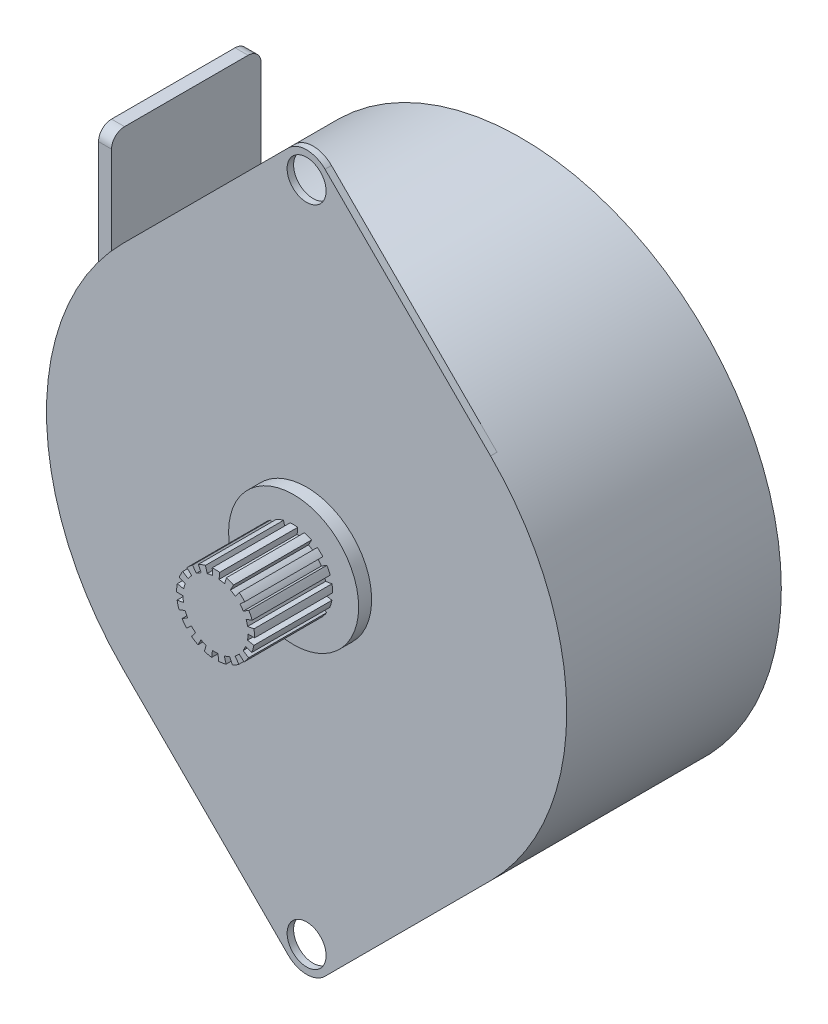
from build123d import *
from build123d.topology import SkipClean

# Parameters (mm, degrees)
SKETCH1_R           = 20
BOSS_EXTRUDE1_DEPTH = 16
BOSS_EXTRUDE3_START = 0.5
SKETCH3_R           = 1.5
BOSS_EXTRUDE3_DEPTH = 0.5
SKETCH4_R           = 5
BOSS_EXTRUDE4_DEPTH = 1
SKETCH5_R           = 3
BOSS_EXTRUDE5_DEPTH = 6
CUT_EXTRUDE1_START  = -6
CUT_EXTRUDE1_DEPTH  = 6
SKETCH8_W           = 11.5
SKETCH8_H           = 23
BOSS_EXTRUDE6_DEPTH = 1
FILLET1_R           = 1


with BuildPart() as part:
    # Sketch1 → Boss-Extrude1 (new body)
    with BuildSketch(Plane.XY):
        Circle(SKETCH1_R)
    extrude(amount=-BOSS_EXTRUDE1_DEPTH)

    # Sketch3 → Boss-Extrude3 (add)
    with SkipClean():  # the faces are left unmerged after this step: merging them gives an invalid solid
        with BuildSketch(Plane.XY.offset(BOSS_EXTRUDE3_START)):
            with BuildLine():
                Line((-14.142135624, 14.142135624), (-1.414213562, 26.870057685))
                ThreePointArc((-1.414213562, 26.870057685), (0, 27.455844123), (1.414213562, 26.870057685))
                Line((1.414213562, 26.870057685), (14.142135624, 14.142135624))
                ThreePointArc((14.142135624, 14.142135624), (20, 0), (14.142135624, -14.142135624))
                Line((14.142135624, -14.142135624), (1.414213562, -26.870057685))
                ThreePointArc((1.414213562, -26.870057685), (0, -27.455844123), (-1.414213562, -26.870057685))
                Line((-1.414213562, -26.870057685), (-14.142135624, -14.142135624))
                ThreePointArc((-14.142135624, -14.142135624), (-20, 0), (-14.142135624, 14.142135624))
            make_face()
            with Locations((0, -25.455844123)):
                Circle(SKETCH3_R, mode=Mode.SUBTRACT)
            with Locations((0, 25.455844123)):
                Circle(SKETCH3_R, mode=Mode.SUBTRACT)
        extrude(amount=-BOSS_EXTRUDE3_DEPTH)

    # Sketch4 → Boss-Extrude4 (add)
    with SkipClean():  # the faces are left unmerged after this step: merging them gives an invalid solid
        with BuildSketch(Plane.XY.offset(0.5)):
            with Locations(Location((0, 0, 0), (0, 0, 180))):
                Circle(SKETCH4_R)
        extrude(amount=BOSS_EXTRUDE4_DEPTH)

    # Sketch5 → Boss-Extrude5 (add)
    with SkipClean():  # the faces are left unmerged after this step: merging them gives an invalid solid
        with BuildSketch(Plane.XY.offset(1.5)):
            Circle(SKETCH5_R)
        extrude(amount=BOSS_EXTRUDE5_DEPTH)

    # Sketch6 → Cut-Extrude1 (cut)
    with SkipClean():  # the faces are left unmerged after this step: merging them gives an invalid solid
        with BuildSketch(Plane.XY.offset(7.5).offset(CUT_EXTRUDE1_START)):
            with BuildLine():
                Line((-2.464171335, -0.421734077), (-2.957005602, -0.506080893))
                ThreePointArc((-2.957005602, -0.506080893), (-2.989861159, -0.246435082), (-2.999962067, 0.015086247))
                Line((-2.999962067, 0.015086247), (-2.499968389, 0.012571873))
                ThreePointArc((-2.499968389, 0.012571873), (-2.491550966, -0.205362569), (-2.464171335, -0.421734077))
            make_face()
            with BuildLine():
                Line((-2.450119259, 0.496906044), (-2.940143111, 0.596287252))
                ThreePointArc((-2.940143111, 0.596287252), (-2.87698512, 0.850268556), (-2.791931536, 1.097778802))
                Line((-2.791931536, 1.097778802), (-2.326609613, 0.914815669))
                ThreePointArc((-2.326609613, 0.914815669), (-2.3974876, 0.70855713), (-2.450119259, 0.496906044))
            make_face()
            with BuildLine():
                Line((-2.145423418, -1.283416674), (-2.574508101, -1.540100009))
                ThreePointArc((-2.574508101, -1.540100009), (-2.698939881, -1.309856297), (-2.802831098, -1.069643789))
                Line((-2.802831098, -1.069643789), (-2.335692582, -0.891369824))
                ThreePointArc((-2.335692582, -0.891369824), (-2.249116567, -1.091546915), (-2.145423418, -1.283416674))
            make_face()
            with BuildLine():
                Line((-2.105165001, 1.34843625), (-2.526198001, 1.6181235))
                ThreePointArc((-2.526198001, 1.6181235), (-2.375556299, 1.832138714), (-2.20683518, 2.032210247))
                Line((-2.20683518, 2.032210247), (-1.839029317, 1.693508539))
                ThreePointArc((-1.839029317, 1.693508539), (-1.979630249, 1.526782262), (-2.105165001, 1.34843625))
            make_face()
            with BuildLine():
                Line((-1.475896544, 2.017852669), (-1.771075853, 2.421423202))
                ThreePointArc((-1.771075853, 2.421423202), (-1.553295437, 2.566568387), (-1.323693504, 2.692180437))
                Line((-1.323693504, 2.692180437), (-1.10307792, 2.243483698))
                ThreePointArc((-1.10307792, 2.243483698), (-1.294412864, 2.138806989), (-1.475896544, 2.017852669))
            make_face()
            with BuildLine():
                Line((-0.64730008, 2.414746903), (-0.776760097, 2.897696284))
                ThreePointArc((-0.776760097, 2.897696284), (-0.521253418, 2.954368778), (-0.261779686, 2.988556741))
                Line((-0.261779686, 2.988556741), (-0.218149739, 2.490463951))
                ThreePointArc((-0.218149739, 2.490463951), (-0.434377848, 2.461973981), (-0.64730008, 2.414746903))
            make_face()
            with BuildLine():
                Line((0.268717846, 2.485516188), (0.322461415, 2.982619425))
                ThreePointArc((0.322461415, 2.982619425), (0.581186763, 2.943165294), (0.835488929, 2.881311897))
                Line((0.835488929, 2.881311897), (0.696240774, 2.401093248))
                ThreePointArc((0.696240774, 2.401093248), (0.484322303, 2.452637745), (0.268717846, 2.485516188))
            make_face()
            with BuildLine():
                Line((1.148443938, 2.220602739), (1.378132725, 2.664723286))
                ThreePointArc((1.378132725, 2.664723286), (1.605134451, 2.534471028), (1.819920135, 2.384929916))
                Line((1.819920135, 2.384929916), (1.516600112, 1.987441596))
                ThreePointArc((1.516600112, 1.987441596), (1.337612043, 2.11205919), (1.148443938, 2.220602739))
            make_face()
            with BuildLine():
                Line((1.873066312, 1.655784585), (2.247679574, 1.986941502))
                ThreePointArc((2.247679574, 1.986941502), (2.412299837, 1.783482407), (2.558561042, 1.566449934))
                Line((2.558561042, 1.566449934), (2.132134202, 1.305374945))
                ThreePointArc((2.132134202, 1.305374945), (2.010249864, 1.486235339), (1.873066312, 1.655784585))
            make_face()
            with BuildLine():
                Line((2.344720702, 0.867343548), (2.813664842, 1.040812257))
                ThreePointArc((2.813664842, 1.040812257), (2.893670764, 0.791624603), (2.951654103, 0.536412208))
                Line((2.951654103, 0.536412208), (2.459711752, 0.447010173))
                ThreePointArc((2.459711752, 0.447010173), (2.411392303, 0.659687169), (2.344720702, 0.867343548))
            make_face()
            with BuildLine():
                Line((2.499707569, -0.038237042), (2.999649082, -0.04588445))
                ThreePointArc((2.999649082, -0.04588445), (2.984235419, -0.307146489), (2.946109922, -0.566070959))
                Line((2.946109922, -0.566070959), (2.455091601, -0.471725799))
                ThreePointArc((2.455091601, -0.471725799), (2.486862849, -0.255955408), (2.499707569, -0.038237042))
            make_face()
            with BuildLine():
                Line((2.317095077, -0.938653506), (2.780514092, -1.126384208))
                ThreePointArc((2.780514092, -1.126384208), (2.671762544, -1.364435747), (2.54267727, -1.592103106))
                Line((2.54267727, -1.592103106), (2.118897725, -1.326752588))
                ThreePointArc((2.118897725, -1.326752588), (2.226468787, -1.137029789), (2.317095077, -0.938653506))
            make_face()
            with BuildLine():
                Line((1.821546055, -1.712299614), (2.185855266, -2.054759537))
                ThreePointArc((2.185855266, -2.054759537), (1.998453334, -2.237450396), (1.795841964, -2.403112906))
                Line((1.795841964, -2.403112906), (1.49653497, -2.002594088))
                ThreePointArc((1.49653497, -2.002594088), (1.665377778, -1.864541996), (1.821546055, -1.712299614))
            make_face()
            with BuildLine():
                Line((1.079987146, -2.254690171), (1.295984575, -2.705628205))
                ThreePointArc((1.295984575, -2.705628205), (1.055241926, -2.808284971), (0.80646825, -2.889568992))
                Line((0.80646825, -2.889568992), (0.672056875, -2.40797416))
                ThreePointArc((0.672056875, -2.40797416), (0.879368272, -2.340237476), (1.079987146, -2.254690171))
            make_face()
            with BuildLine():
                Line((0.192569987, -2.492572326), (0.231083985, -2.991086791))
                ThreePointArc((0.231083985, -2.991086791), (-0.03048575, -2.999845099), (-0.291823471, -2.985772775))
                Line((-0.291823471, -2.985772775), (-0.243186225, -2.488143979))
                ThreePointArc((-0.243186225, -2.488143979), (-0.025404792, -2.499870916), (0.192569987, -2.492572326))
            make_face()
            with BuildLine():
                Line((-0.720854815, -2.393818777), (-0.865025778, -2.872582532))
                ThreePointArc((-0.865025778, -2.872582532), (-1.112096158, -2.786259524), (-1.350702814, -2.678731399))
                Line((-1.350702814, -2.678731399), (-1.125585679, -2.232276166))
                ThreePointArc((-1.125585679, -2.232276166), (-0.926746798, -2.321882937), (-0.720854815, -2.393818777))
            make_face()
            with BuildLine():
                Line((-1.53692418, -1.971766737), (-1.844309015, -2.366120085))
                ThreePointArc((-1.844309015, -2.366120085), (-2.043511816, -2.196374161), (-2.227162258, -2.009912504))
                Line((-2.227162258, -2.009912504), (-1.855968549, -1.674927087))
                ThreePointArc((-1.855968549, -1.674927087), (-1.702926514, -1.830311801), (-1.53692418, -1.971766737))
            make_face()
        extrude(amount=CUT_EXTRUDE1_DEPTH, mode=Mode.SUBTRACT)


with BuildPart() as body_2:
    # Sketch8 → Boss-Extrude6 (new body)
    with BuildSketch(Plane.ZY.offset(20)):
        with Locations((-10.25, 4.5)):
            Rectangle(SKETCH8_W, SKETCH8_H)
    extrude(amount=BOSS_EXTRUDE6_DEPTH)

    # Fillet1
    fillet1_edges = [body_2.edges().sort_by_distance(p)[0] for p in [
        (-20.5, 16, -16),
        (-20.5, 16, -4.5),
        (-20.5, -7, -4.5),
        (-20.5, -7, -16),
    ]]
    fillet(fillet1_edges, radius=FILLET1_R)


solid = Compound([part.part, body_2.part])
